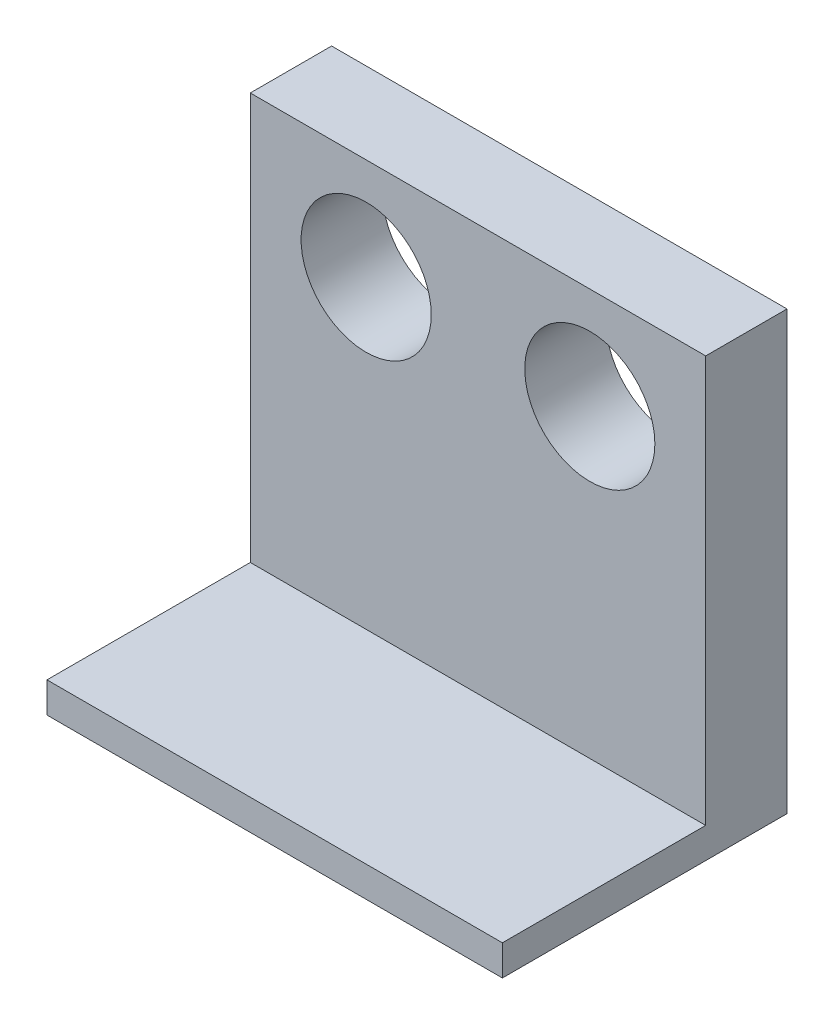
from build123d import *

# Parameters (mm, degrees)
CROQUIS7_W              = 44.8
CROQUIS7_H              = 43
CROQUIS7_R              = 6.4
SALIENTE_EXTRUIR4_DEPTH = 8
CROQUIS8_W              = 44.8
CROQUIS8_H              = 3
SALIENTE_EXTRUIR5_DEPTH = 20


with BuildPart() as part:
    # Croquis7 → Saliente-Extruir4 (new body)
    with BuildSketch(Plane.XY):
        Rectangle(CROQUIS7_W, CROQUIS7_H)
        with Locations((-11, 11.5)):
            Circle(CROQUIS7_R, mode=Mode.SUBTRACT)
        with Locations((11, 11.5)):
            Circle(CROQUIS7_R, mode=Mode.SUBTRACT)
    extrude(amount=SALIENTE_EXTRUIR4_DEPTH)

    # Croquis8 → Saliente-Extruir5 (add)
    with BuildSketch(Plane.XY.offset(8)):
        with Locations((0, -20)):
            Rectangle(CROQUIS8_W, CROQUIS8_H)
    extrude(amount=SALIENTE_EXTRUIR5_DEPTH)


solid = part.part
